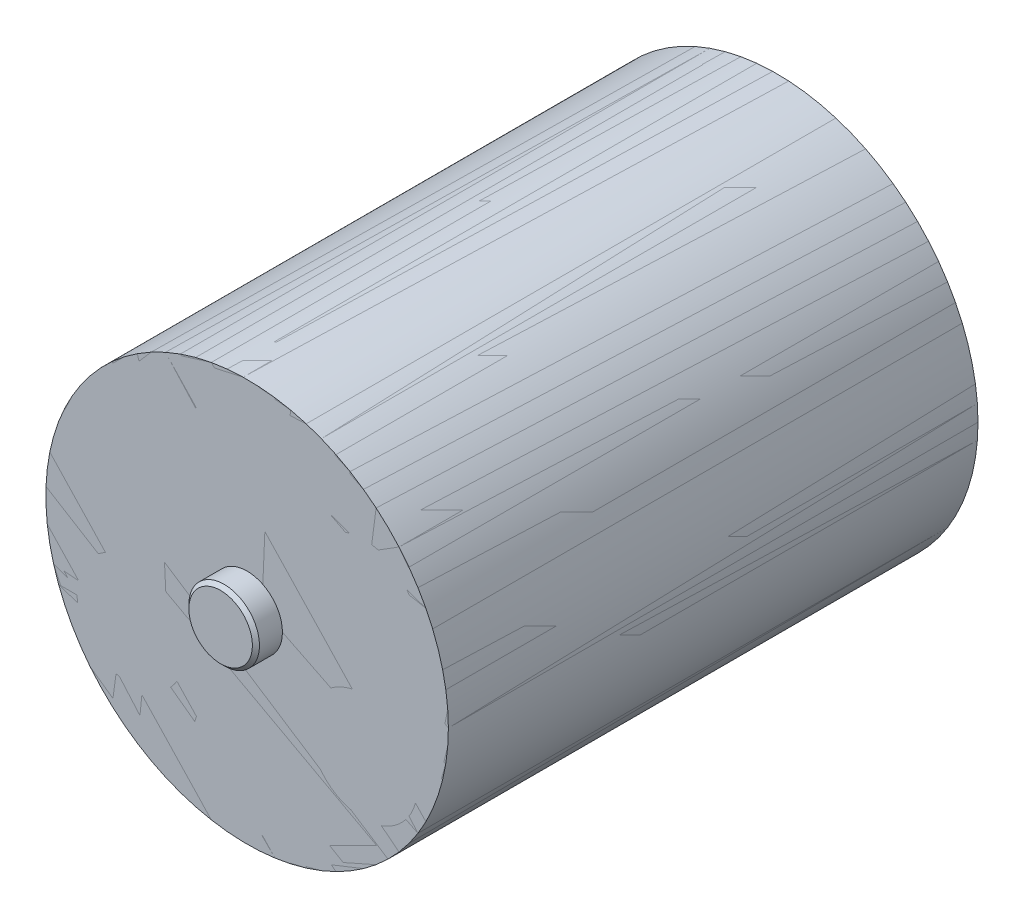
from build123d import *

# Parameters (mm, degrees)
SKETCH1_R               = 114
BOSS_EXTRUDE1_DEPTH     = 150
SKETCH2_R               = 30.583998029
CUT_EXTRUDE1_DEPTH      = 5
CIRPATTERN1_COUNT       = 6
MIRROR1_COPY_1_SKETCH_R = 30.583998029
MIRROR1_COPY_1_DEPTH    = 5
MIRROR1_COPY_2_SKETCH_R = 30.583998029
MIRROR1_COPY_2_DEPTH    = 5
MIRROR1_COPY_3_SKETCH_R = 30.583998029
MIRROR1_COPY_3_DEPTH    = 5
MIRROR1_COPY_4_SKETCH_R = 30.583998029
MIRROR1_COPY_4_DEPTH    = 5
MIRROR1_COPY_5_SKETCH_R = 30.583998029
MIRROR1_COPY_5_DEPTH    = 5
SKETCH3_R               = 20
BOSS_EXTRUDE2_DEPTH     = 15
CHAMFER1_SIZE           = 2
SKETCH4_R               = 114
BOSS_EXTRUDE3_DEPTH     = 300


with BuildPart() as part:
    # Sketch1 → Boss-Extrude1 (new, symmetric)
    with BuildSketch(Plane.XY):
        with Locations((271.211975439, 413.994449049)):
            Circle(SKETCH1_R)
    extrude(amount=BOSS_EXTRUDE1_DEPTH, both=True)

    # Sketch2 → Cut-Extrude1 (cut)
    with BuildSketch(Plane.XY.offset(150)):
        with Locations((271.211975439, 490.065575896)):
            Circle(SKETCH2_R)
    cut_extrude1 = extrude(amount=-CUT_EXTRUDE1_DEPTH, mode=Mode.SUBTRACT)

    # CirPattern1: Cut-Extrude1 ×6 about axis
    cirpattern1_axis = Axis((271.211975439, 413.994449049, 0), (0, 0, 1))
    for i in range(1, CIRPATTERN1_COUNT):
        add(cut_extrude1.rotate(cirpattern1_axis, i * 360 / CIRPATTERN1_COUNT), mode=Mode.SUBTRACT)

    # Mirror1: Cut-Extrude1 across plane
    add(cut_extrude1.mirror(Plane.XY), mode=Mode.SUBTRACT)

    # Mirror1 copy 1 sketch → Mirror1 copy 1 (cut)
    with BuildSketch(Plane(origin=(494.135697622, -27.879236016, -150), x_dir=(0.5000000000000001, 0.8660254037844386, 0), z_dir=(0, 0, -1))):
        with Locations((271.211975439, -490.065575896)):
            Circle(MIRROR1_COPY_1_SKETCH_R)
    extrude(amount=-MIRROR1_COPY_1_DEPTH, mode=Mode.SUBTRACT)

    # Mirror1 copy 2 sketch → Mirror1 copy 2 (cut)
    with BuildSketch(Plane(origin=(765.347673061, 386.115213033, -150), x_dir=(-0.4999999999999998, 0.8660254037844387, 0), z_dir=(0, 0, -1))):
        with Locations((271.211975439, -490.065575896)):
            Circle(MIRROR1_COPY_2_SKETCH_R)
    extrude(amount=-MIRROR1_COPY_2_DEPTH, mode=Mode.SUBTRACT)

    # Mirror1 copy 3 sketch → Mirror1 copy 3 (cut)
    with BuildSketch(Plane(origin=(542.423950878, 827.988898099, -150), x_dir=(-1, 0, 0), z_dir=(0, 0, -1))):
        with Locations((271.211975439, -490.065575896)):
            Circle(MIRROR1_COPY_3_SKETCH_R)
    extrude(amount=-MIRROR1_COPY_3_DEPTH, mode=Mode.SUBTRACT)

    # Mirror1 copy 4 sketch → Mirror1 copy 4 (cut)
    with BuildSketch(Plane(origin=(48.288253256, 855.868134114, -150), x_dir=(-0.5000000000000004, -0.8660254037844384, 0), z_dir=(0, 0, -1))):
        with Locations((271.211975439, -490.065575896)):
            Circle(MIRROR1_COPY_4_SKETCH_R)
    extrude(amount=-MIRROR1_COPY_4_DEPTH, mode=Mode.SUBTRACT)

    # Mirror1 copy 5 sketch → Mirror1 copy 5 (cut)
    with BuildSketch(Plane(origin=(-222.923722183, 441.873685065, -150), x_dir=(0.5000000000000001, -0.8660254037844386, 0), z_dir=(0, 0, -1))):
        with Locations((271.211975439, -490.065575896)):
            Circle(MIRROR1_COPY_5_SKETCH_R)
    extrude(amount=-MIRROR1_COPY_5_DEPTH, mode=Mode.SUBTRACT)

    # Sketch3 → Boss-Extrude2 (add)
    with BuildSketch(Plane.XY.offset(150)):
        with Locations((271.211975439, 413.994449049)):
            Circle(SKETCH3_R)
    boss_extrude2 = extrude(amount=BOSS_EXTRUDE2_DEPTH)

    # Chamfer1
    chamfer1_edges = [part.edges().sort_by_distance(p)[0] for p in [
        (251.211975439, 413.994449049, 165),
    ]]
    chamfer(chamfer1_edges, length=CHAMFER1_SIZE)

    # Mirror4: Boss-Extrude2 across plane
    add(boss_extrude2.mirror(Plane.XY))


with BuildPart() as body_2:
    # Sketch4 → Boss-Extrude3 (new body)
    with BuildSketch(Plane.XY.offset(150)):
        with Locations((271.211975439, 413.994449049)):
            Circle(SKETCH4_R)
    extrude(amount=-BOSS_EXTRUDE3_DEPTH)


solid = Compound([part.part, body_2.part])
